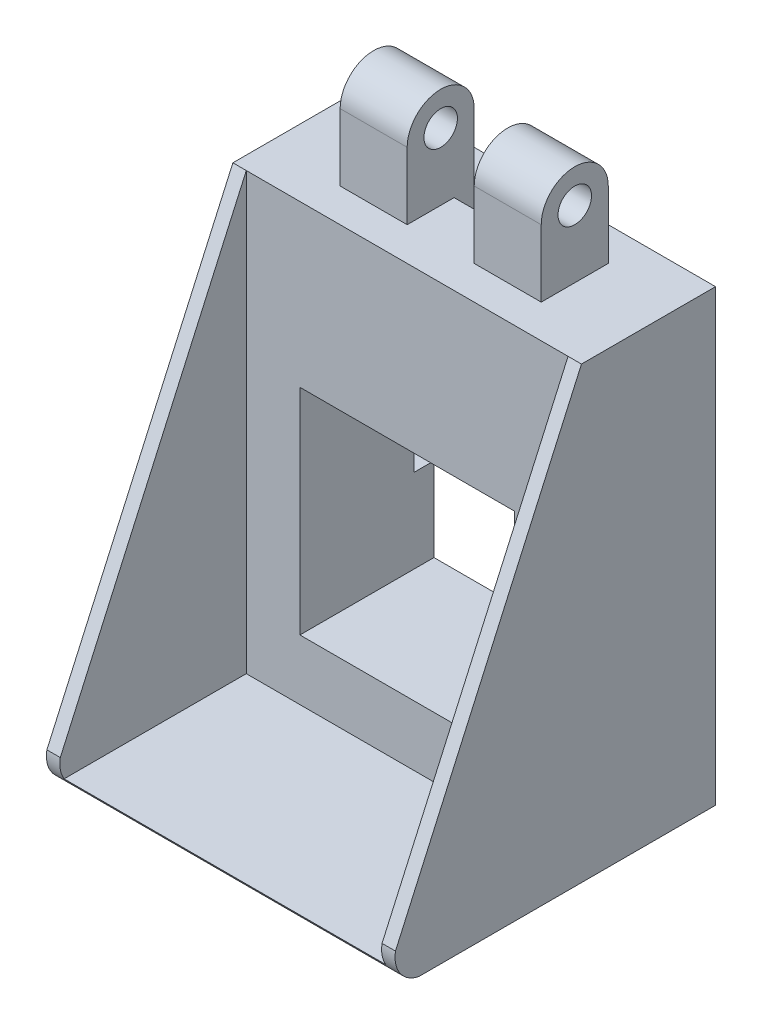
from build123d import *

# Parameters (mm, degrees)
SKETCH1_W            = 50
SKETCH1_H            = 40
BOSS_EXTRUDE1_DEPTH  = 10
SKETCH5_W            = 6
SKETCH5_H            = 5
BOSS_EXTRUDE3_DEPTH  = 10
SKETCH6_R            = 2
CUT_EXTRUDE1_DEPTH   = 20
SKETCH8_W            = 10
SKETCH8_H            = 40
CUT_EXTRUDE2_DEPTH   = 25
SKETCH9_W            = 10
SKETCH9_H            = 6
SKETCH9_R            = 1.930897171
BOSS_EXTRUDE4_DEPTH  = 5
SKETCH10_W           = 10
SKETCH10_H           = 5
CUT_EXTRUDE3_DEPTH   = 15
SKETCH11_W           = 5
SKETCH11_H           = 5
BOSS_EXTRUDE5_DEPTH  = 10
SKETCH12_R           = 1.5
CUT_EXTRUDE4_DEPTH   = 10
SKETCH13_W           = 6
SKETCH13_H           = 5
CUT_EXTRUDE5_DEPTH   = 10
SKETCH15_W           = 5
SKETCH15_H           = 5
BOSS_EXTRUDE7_DEPTH  = 10
SKETCH18_W           = 5
SKETCH18_H           = 5
CUT_EXTRUDE7_DEPTH   = 10
SKETCH19_R           = 1.25
CUT_EXTRUDE8_DEPTH   = 43
CUT_EXTRUDE9_DEPTH   = 20
SKETCH21_W           = 16
SKETCH21_H           = 16
CUT_EXTRUDE10_DEPTH  = 30
SKETCH22_W           = 8
SKETCH22_H           = 12
CUT_EXTRUDE11_DEPTH  = 4
SCALE2_SCALE         = 2
CUT_EXTRUDE12_DEPTH  = 30
SKETCH24_W           = 44
SKETCH24_H           = 7
CUT_EXTRUDE13_DEPTH  = 3
SKETCH25_W           = 3
SKETCH25_H           = 8
BOSS_EXTRUDE8_DEPTH  = 8
BOSS_EXTRUDE9_DEPTH  = 2
SKETCH27_W           = 52
SKETCH27_H           = 50
BOSS_EXTRUDE10_DEPTH = 2
BOSS_EXTRUDE11_DEPTH = 2
CUT_EXTRUDE15_DEPTH  = 64


with BuildPart() as part:
    # Sketch1 → Boss-Extrude1 (new body)
    with BuildSketch(Plane(origin=(669.84184187, 0, 0), x_dir=(1, 0, 0), z_dir=(0, 0, 1))):
        with Locations((-671.310344828, 437.637931034)):
            Rectangle(SKETCH1_W, SKETCH1_H)
    boss_extrude1 = extrude(amount=BOSS_EXTRUDE1_DEPTH)

    # Sketch5 → Boss-Extrude3 (add)
    with BuildSketch(Plane(origin=(23.531497042, 0, 0), x_dir=(0, 0, -1), z_dir=(1, 0, 0))):
        with Locations((-5, 442.637931034)):
            Rectangle(SKETCH5_W, SKETCH5_H)
        with Locations((-5, 432.637931034)):
            Rectangle(SKETCH5_W, SKETCH5_H)
    extrude(amount=BOSS_EXTRUDE3_DEPTH)

    # Sketch6 → Cut-Extrude1 (cut)
    with BuildSketch(Plane(origin=(669.84184187, 445.137931034, 0), x_dir=(1, 0, 0), z_dir=(0, 1, 0))):
        with Locations(Location((-641.310344828, -5, 0), (0, 0, 180))):
            Circle(SKETCH6_R)
    extrude(amount=-CUT_EXTRUDE1_DEPTH, mode=Mode.SUBTRACT)

    # Sketch8 → Cut-Extrude2 (cut)
    with BuildSketch(Plane.ZY.offset(26.468502958)):
        with Locations((5, 437.637931034)):
            Rectangle(SKETCH8_W, SKETCH8_H)
    extrude(amount=-CUT_EXTRUDE2_DEPTH, mode=Mode.SUBTRACT)

    # Sketch9 → Boss-Extrude4 (add)
    with BuildSketch(Plane(origin=(0, 435.137931034, 0), x_dir=(1, 0, 0), z_dir=(0, 1, 0))):
        with Locations((28.531497042, -5)):
            Rectangle(SKETCH9_W, SKETCH9_H)
        with Locations(Location((28.531497042, -5, 0), (0, 0, 180))):
            Circle(SKETCH9_R, mode=Mode.SUBTRACT)
    extrude(amount=BOSS_EXTRUDE4_DEPTH)

    # Sketch10 → Cut-Extrude3 (cut)
    with BuildSketch(Plane.XY.offset(8)):
        with Locations((28.531497042, 432.637931034)):
            Rectangle(SKETCH10_W, SKETCH10_H)
        with Locations((28.531497042, 442.637931034)):
            Rectangle(SKETCH10_W, SKETCH10_H)
    extrude(amount=-CUT_EXTRUDE3_DEPTH, mode=Mode.SUBTRACT)

    # Mirror1: Boss-Extrude1 across plane
    add(boss_extrude1.mirror(Plane(origin=(-1.468502958, 0, 0), x_dir=(0, 0, 1), z_dir=(1, 0, 0))))

    # Sketch11 → Boss-Extrude5 (add)
    with BuildSketch(Plane(origin=(0, 457.637931034, 0), x_dir=(1, 0, 0), z_dir=(0, 1, 0))):
        with Locations((-1.468502958, -5)):
            Rectangle(SKETCH11_W, SKETCH11_H)
    extrude(amount=BOSS_EXTRUDE5_DEPTH)

    # Sketch12 → Cut-Extrude4 (cut)
    with BuildSketch(Plane(origin=(1.031497042, 0, 0), x_dir=(0, 0, -1), z_dir=(1, 0, 0))):
        with Locations((-5, 462.637931034)):
            Circle(SKETCH12_R)
    extrude(amount=-CUT_EXTRUDE4_DEPTH, mode=Mode.SUBTRACT)

    # Sketch13 → Cut-Extrude5 (cut)
    with BuildSketch(Plane(origin=(33.531497042, 0, 0), x_dir=(0, 0, -1), z_dir=(1, 0, 0))):
        with Locations((-5, 437.637931034)):
            Rectangle(SKETCH13_W, SKETCH13_H)
    extrude(amount=-CUT_EXTRUDE5_DEPTH, mode=Mode.SUBTRACT)

    # Sketch15 → Boss-Extrude7 (add)
    with BuildSketch(Plane(origin=(0, 457.637931034, 0), x_dir=(1, 0, 0), z_dir=(0, 1, 0))):
        with Locations((-6.468502958, -5)):
            Rectangle(SKETCH15_W, SKETCH15_H)
        with Locations((3.531497042, -5)):
            Rectangle(SKETCH15_W, SKETCH15_H)
    extrude(amount=BOSS_EXTRUDE7_DEPTH)

    # Sketch18 → Cut-Extrude7 (cut)
    with BuildSketch(Plane(origin=(0, 467.637931034, 0), x_dir=(1, 0, 0), z_dir=(0, 1, 0))):
        with Locations((-1.468502958, -5)):
            Rectangle(SKETCH18_W, SKETCH18_H)
    extrude(amount=-CUT_EXTRUDE7_DEPTH, mode=Mode.SUBTRACT)

    # Sketch19 → Cut-Extrude8 (cut)
    with BuildSketch(Plane.ZY.offset(8.968502958)):
        with Locations((5, 462.637931034)):
            Circle(SKETCH19_R)
    extrude(amount=-CUT_EXTRUDE8_DEPTH, mode=Mode.SUBTRACT)

    # Sketch20 → Cut-Extrude9 (cut)
    with BuildSketch(Plane(origin=(6.031497042, 0, 0), x_dir=(0, 0, -1), z_dir=(1, 0, 0))):
        with BuildLine():
            Line((-7.5, 467.637931034), (-7.5, 462.637931034))
            ThreePointArc((-7.5, 462.637931034), (-5, 465.137931034), (-2.5, 462.637931034))
            Line((-2.5, 462.637931034), (-2.5, 467.637931034))
            Line((-2.5, 467.637931034), (-7.5, 467.637931034))
        make_face()
    extrude(amount=-CUT_EXTRUDE9_DEPTH, mode=Mode.SUBTRACT)

    # Sketch21 → Cut-Extrude10 (cut)
    with BuildSketch(Plane.XY.offset(10)):
        with Locations((-1.468502958, 437.637931034)):
            Rectangle(SKETCH21_W, SKETCH21_H)
    extrude(amount=-CUT_EXTRUDE10_DEPTH, mode=Mode.SUBTRACT)

    # Sketch22 → Cut-Extrude11 (cut)
    with BuildSketch(Plane(origin=(0, 0, 0), x_dir=(-1, 0, 0), z_dir=(0, 0, -1))):
        with Locations((1.468502958, 451.637931034)):
            Rectangle(SKETCH22_W, SKETCH22_H)
    extrude(amount=-CUT_EXTRUDE11_DEPTH, mode=Mode.SUBTRACT)


with BuildPart() as part_1:
    # Scale2: scaled about (-1.468502958, 437.728990864, 5.066378231)
    add(part.part.scale(SCALE2_SCALE).moved(Location((1.468502958, -437.728990864, -5.066378231))))

    # Sketch23 → Cut-Extrude12 (cut)
    with BuildSketch(Plane(origin=(0, 0, -5.066378231), x_dir=(-1, 0, 0), z_dir=(0, 0, -1))):
        Polygon((27.468502958, 495.287404552), (27.468502958, 477.546871205), (51.468502958, 477.546871205), (51.468502958, 397.546871205), (-48.531497042, 397.546871205), (-48.531497042, 477.546871205), (-24.531497042, 477.546871205), (-24.531497042, 495.287404552), (-71.530370383, 495.287404552), (-71.530370383, 371.111775085), (85.960671869, 371.111775085), (85.960671869, 495.287404552), align=None)
        Polygon((51.468502958, 477.546871205), (27.468502958, 477.546871205), (27.468502958, 410.546871205), (-24.531497042, 410.546871205), (-24.531497042, 477.546871205), (-48.531497042, 477.546871205), (-48.531497042, 397.546871205), (51.468502958, 397.546871205), align=None)
    extrude(amount=-CUT_EXTRUDE12_DEPTH, mode=Mode.SUBTRACT)

    # Sketch24 → Cut-Extrude13 (cut)
    with BuildSketch(Plane(origin=(0, 0, -5.066378231), x_dir=(-1, 0, 0), z_dir=(0, 0, -1))):
        with Locations((1.468502958, 437.546871205)):
            Rectangle(SKETCH24_W, SKETCH24_H)
    extrude(amount=-CUT_EXTRUDE13_DEPTH, mode=Mode.SUBTRACT)

    # Sketch25 → Boss-Extrude8 (add)
    with BuildSketch(Plane(origin=(0, 0, 2.933621769), x_dir=(-1, 0, 0), z_dir=(0, 0, -1))):
        with Locations((-5.031497042, 473.546871205)):
            Rectangle(SKETCH25_W, SKETCH25_H)
        with Locations((7.968502958, 473.546871205)):
            Rectangle(SKETCH25_W, SKETCH25_H)
    extrude(amount=BOSS_EXTRUDE8_DEPTH)

    # Sketch26 → Boss-Extrude9 (add)
    with BuildSketch(Plane.ZY.offset(27.468502958)):
        Polygon((44.933621769, 410.546871205), (14.933621769, 477.546871205), (14.933621769, 410.546871205), align=None)
    extrude(amount=-BOSS_EXTRUDE9_DEPTH)

    # Sketch27 → Boss-Extrude10 (add)
    with BuildSketch(Plane.XZ.offset(-410.546871205)):
        with Locations((-1.468502958, 19.933621769)):
            Rectangle(SKETCH27_W, SKETCH27_H)
    extrude(amount=-BOSS_EXTRUDE10_DEPTH)

    # Sketch28 → Boss-Extrude11 (add)
    with BuildSketch(Plane(origin=(24.531497042, 0, 0), x_dir=(0, 0, -1), z_dir=(1, 0, 0))):
        Polygon((-14.933621769, 477.546871205), (-44.933621769, 410.546871205), (5.066378231, 410.546871205), align=None)
    extrude(amount=-BOSS_EXTRUDE11_DEPTH)

    # Sketch31 → Cut-Extrude15 (cut)
    with BuildSketch(Plane(origin=(24.531497042, 0, 0), x_dir=(0, 0, -1), z_dir=(1, 0, 0))):
        with BuildLine():
            Line((-42.679814302, 415.580374548), (-51.64215649, 418.145209821))
            Line((-51.64215649, 418.145209821), (-53.81664241, 410.546871205))
            Line((-53.81664241, 410.546871205), (-41.973839944, 407.710599457))
            Line((-41.973839944, 407.710599457), (-39.182920234, 410.546871205))
            ThreePointArc((-39.182920234, 410.546871205), (-41.973839944, 412.339392402), (-42.679814302, 415.580374548))
        make_face()
    extrude(amount=-CUT_EXTRUDE15_DEPTH, mode=Mode.SUBTRACT)


solid = part_1.part
